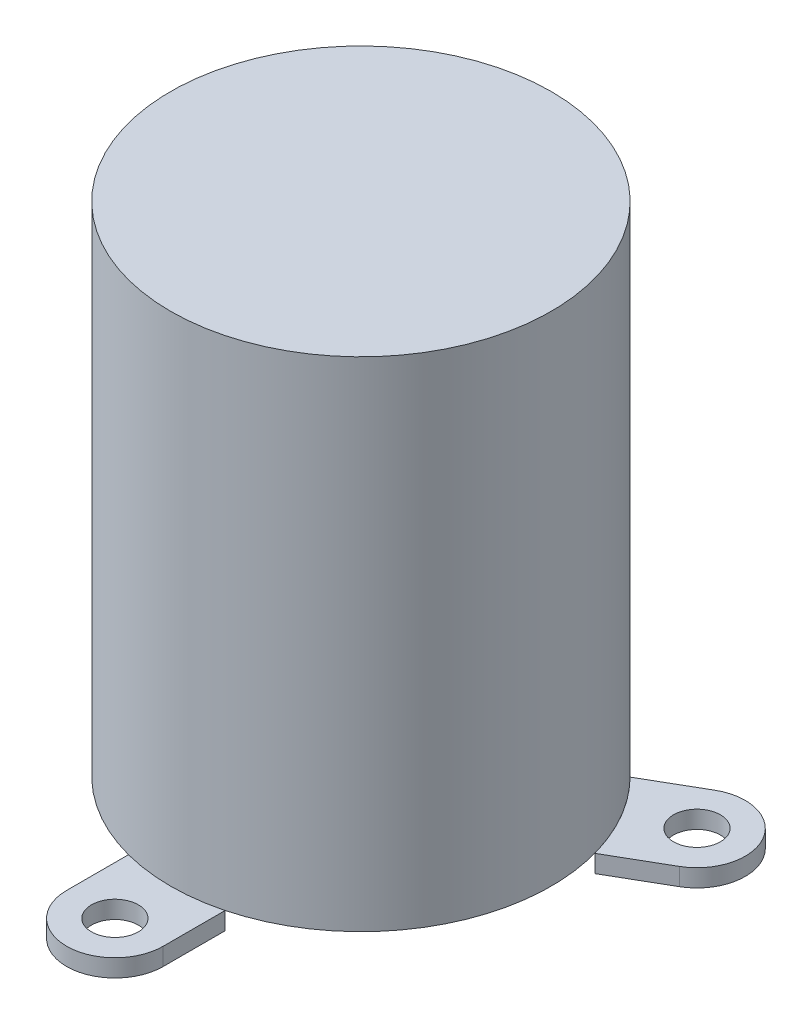
from build123d import *

# Parameters (mm, degrees)
SKETCH1_R             = 6.5
BOSS_EXTRUDE1_DEPTH   = 17
SKETCH2_R             = 0.8
BOSS_EXTRUDE2_DEPTH   = 0.6
BOSS_EXTRUDE2_2_DEPTH = 0.6
BOSS_EXTRUDE2_3_DEPTH = 0.6


with BuildPart() as part:
    # Sketch1 → Boss-Extrude1 (new body)
    with BuildSketch(Plane(origin=(0, 0, 0), x_dir=(1, 0, 0), z_dir=(0, 1, 0))):
        with Locations(Location((0, 0, 0), (0, 0, 270))):
            Circle(SKETCH1_R)
    extrude(amount=BOSS_EXTRUDE1_DEPTH)


with BuildPart() as body_2:
    # Sketch2 → Boss-Extrude2 (new body)
    with BuildSketch(Plane(origin=(0, 0, 0), x_dir=(-1, 0, 0), z_dir=(0, -1, 0))):
        with BuildLine():
            Line((1.65, -6.287089947), (1.65, -8.4))
            ThreePointArc((1.65, -8.4), (0, -10.05), (-1.65, -8.4))
            Line((-1.65, -8.4), (-1.65, -6.287089947))
            ThreePointArc((-1.65, -6.287089947), (0, -6.5), (1.65, -6.287089947))
        make_face()
        with Locations(Location((0, -8.4, 0), (0, 0, 90))):
            Circle(SKETCH2_R, mode=Mode.SUBTRACT)
    extrude(amount=BOSS_EXTRUDE2_DEPTH)


with BuildPart() as body_3:
    # Sketch2 → Boss-Extrude2 2 (new body)
    with BuildSketch(Plane(origin=(0, 0, 0), x_dir=(-1, 0, 0), z_dir=(0, -1, 0))):
        with BuildLine():
            Line((-6.26977961, 1.714603057), (-8.099613392, 2.771058084))
            ThreePointArc((-8.099613392, 2.771058084), (-8.703555308, 5.025), (-6.449613392, 5.628941916))
            Line((-6.449613392, 5.628941916), (-4.61977961, 4.57248689))
            ThreePointArc((-4.61977961, 4.57248689), (-5.629165125, 3.25), (-6.26977961, 1.714603057))
        make_face()
        with Locations(Location((-7.274613392, 4.2, 0), (0, 0, 90))):
            Circle(SKETCH2_R, mode=Mode.SUBTRACT)
    extrude(amount=BOSS_EXTRUDE2_2_DEPTH)


with BuildPart() as body_4:
    # Sketch2 → Boss-Extrude2 3 (new body)
    with BuildSketch(Plane(origin=(0, 0, 0), x_dir=(-1, 0, 0), z_dir=(0, -1, 0))):
        with BuildLine():
            Line((4.61977961, 4.57248689), (6.449613392, 5.628941916))
            ThreePointArc((6.449613392, 5.628941916), (8.703555308, 5.025), (8.099613392, 2.771058084))
            Line((8.099613392, 2.771058084), (6.26977961, 1.714603057))
            ThreePointArc((6.26977961, 1.714603057), (5.629165125, 3.25), (4.61977961, 4.57248689))
        make_face()
        with Locations(Location((7.274613392, 4.2, 0), (0, 0, 90))):
            Circle(SKETCH2_R, mode=Mode.SUBTRACT)
    extrude(amount=BOSS_EXTRUDE2_3_DEPTH)


solid = Compound([part.part, body_2.part, body_3.part, body_4.part])
